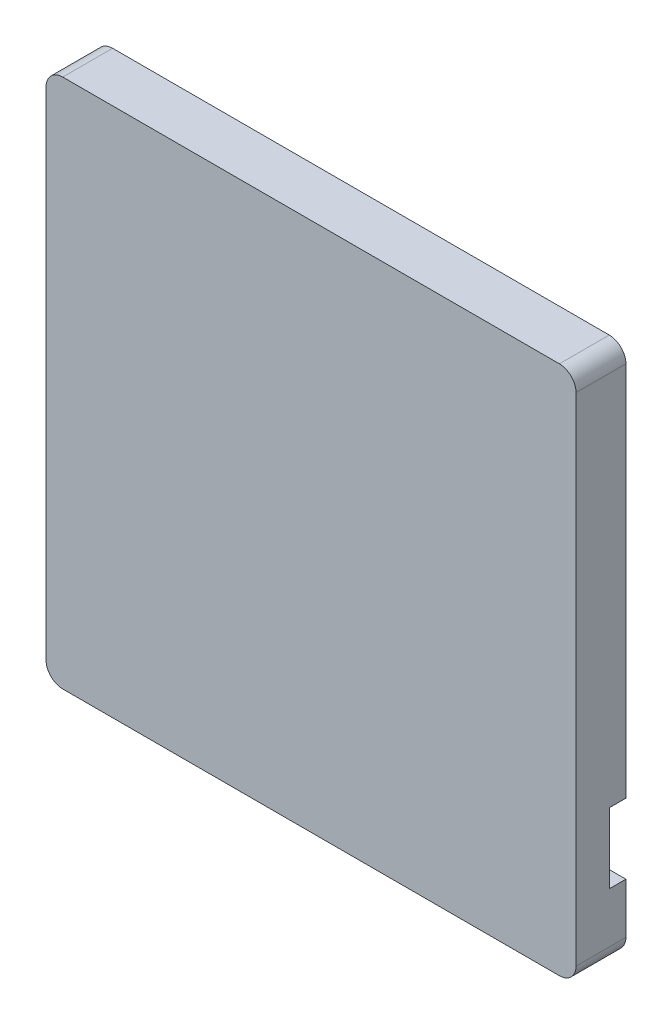
from build123d import *

# Parameters (mm, degrees)
EXTRUDE_1_DEPTH = 10
SKETCH_4_W      = 318.818129974
SKETCH_4_H      = 318.818129974
EXTRUDE_3_DEPTH = 20
SKETCH_6_R      = 42
EXTRUDE_4_DEPTH = 85
FILLET_1_R      = 10


with BuildPart() as part:
    # 草图2 → 凸台-拉伸1 (new body)
    with BuildSketch(Plane.XY):
        with BuildLine():
            Line((171.296424673, 156.614258314), (-147.521705301, 156.614258314))
            Line((-147.521705301, 156.614258314), (-147.521705301, -162.20387166))
            Line((-147.521705301, -162.20387166), (171.296424673, -162.20387166))
            Line((171.296424673, -162.20387166), (171.296424673, -121.894806673))
            Line((171.296424673, -121.894806673), (129.887359686, -121.894806673))
            Line((129.887359686, -121.894806673), (129.887359686, -129.352869657))
            Line((129.887359686, -129.352869657), (124.15096929, -129.294806673))
            Line((124.15096929, -129.294806673), (108.887359686, -129.294806673))
            Line((108.887359686, -129.294806673), (108.887359686, -85.749257823))
            ThreePointArc((108.887359686, -85.749257823), (105.533737001, -87.272944854), (101.887359686, -87.794806673))
            Line((101.887359686, -87.794806673), (77.887359686, -87.794806673))
            Line((77.887359686, -87.794806673), (77.887359686, -121.794806673))
            Line((77.887359686, -121.794806673), (-54.112640314, -121.794806673))
            Line((-54.112640314, -121.794806673), (-54.112640314, -87.794806673))
            Line((-54.112640314, -87.794806673), (-78.112640314, -87.794806673))
            ThreePointArc((-78.112640314, -87.794806673), (-87.305028469, -83.987194828), (-91.112640314, -74.794806673))
            Line((-91.112640314, -74.794806673), (-91.112640314, 87.205193327))
            ThreePointArc((-91.112640314, 87.205193327), (-87.305028469, 96.397581483), (-78.112640314, 100.205193327))
            Line((-78.112640314, 100.205193327), (101.887359686, 100.205193327))
            ThreePointArc((101.887359686, 100.205193327), (111.079747841, 96.397581483), (114.887359686, 87.205193327))
            Line((114.887359686, 87.205193327), (114.887359686, -31.294806673))
            Line((114.887359686, -31.294806673), (133.387359686, -31.294806673))
            Line((133.387359686, -31.294806673), (133.387359686, -37.294806673))
            Line((133.387359686, -37.294806673), (133.387359686, -73.794806673))
            Line((133.387359686, -73.794806673), (129.887359686, -73.794806673))
            Line((129.887359686, -73.794806673), (129.887359686, -79.694806673))
            Line((129.887359686, -79.694806673), (171.296424673, -79.694806673))
            Line((171.296424673, -79.694806673), (171.296424673, 156.614258314))
        make_face()
    extrude(amount=EXTRUDE_1_DEPTH)

    # 草图4 → 凸台-拉伸3 (add)
    with BuildSketch(Plane.XY.offset(10)):
        with Locations((11.887359686, -2.794806673)):
            Rectangle(SKETCH_4_W, SKETCH_4_H)
    extrude(amount=EXTRUDE_3_DEPTH)

    # 草图6 → 凸台-拉伸4 (add)
    with BuildSketch(Plane(origin=(0, 0, 10), x_dir=(-1, 0, 0), z_dir=(0, 0, -1))):
        with Locations(Location((-11.887359686, -2.794806673, 0), (0, 0, 180))):
            Circle(SKETCH_6_R)
    extrude(amount=EXTRUDE_4_DEPTH)

    # 圆角1
    fillet_1_edges = [part.edges().sort_by_distance(p)[0] for p in [
        (171.296424673, -162.20387166, 15),
        (-147.521705301, -162.20387166, 15),
        (-147.521705301, 156.614258314, 15),
        (171.296424673, 156.614258314, 15),
    ]]
    fillet(fillet_1_edges, radius=FILLET_1_R)


solid = part.part
